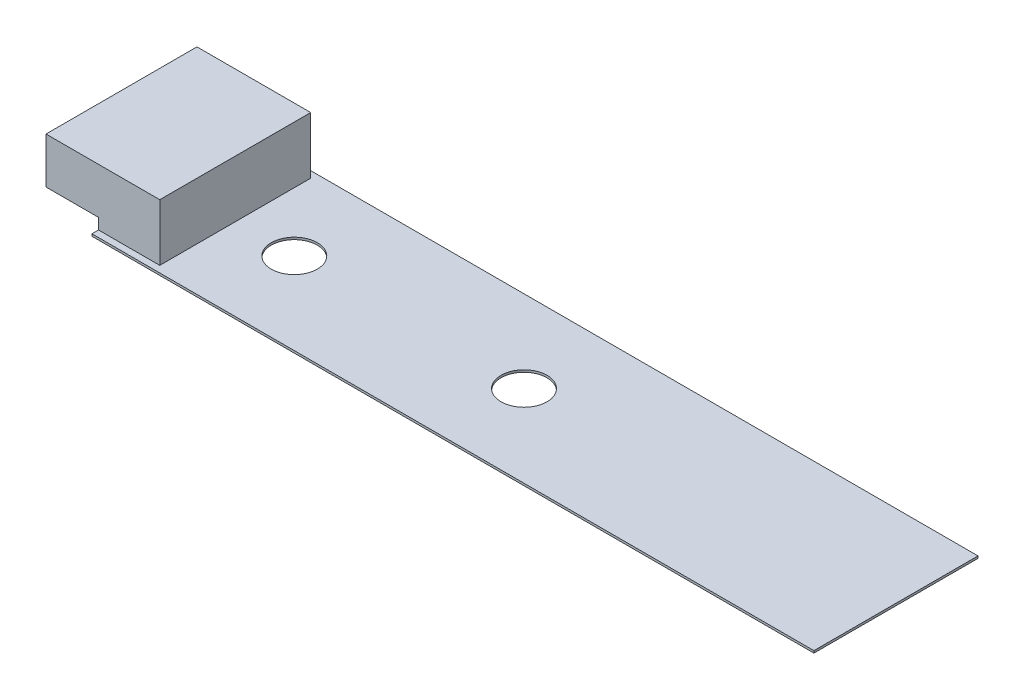
from build123d import *

# Parameters (mm, degrees)
SKETCH1_W           = 33
SKETCH1_H           = 7.5
BOSS_EXTRUDE1_DEPTH = 0.1
SKETCH2_W           = 5.2
SKETCH2_H           = 6.9
BOSS_EXTRUDE2_DEPTH = 2.6
CHAMFER1_SIZE       = 0.5
SKETCH3_R           = 1.05
CUT_EXTRUDE1_DEPTH  = 2.6


with BuildPart() as part:
    # Sketch1 → Boss-Extrude1 (new body)
    with BuildSketch(Plane(origin=(0, 0, 0), x_dir=(1, 0, 0), z_dir=(0, 1, 0))):
        with Locations((16.5, 3.75)):
            Rectangle(SKETCH1_W, SKETCH1_H)
    extrude(amount=BOSS_EXTRUDE1_DEPTH)

    # Sketch2 → Boss-Extrude2 (add)
    with BuildSketch(Plane(origin=(0, 0.1, 0), x_dir=(1, 0, 0), z_dir=(0, 1, 0))):
        with Locations((0.2, 3.75)):
            Rectangle(SKETCH2_W, SKETCH2_H)
    extrude(amount=BOSS_EXTRUDE2_DEPTH)

    # Chamfer1
    chamfer1_edges = [part.edges().sort_by_distance(p)[0] for p in [
        (-1.2, 0.1, -0.3),
        (-1.2, 0.1, -7.2),
    ]]
    chamfer(chamfer1_edges, length=CHAMFER1_SIZE)

    # Sketch3 → Cut-Extrude1 (cut)
    with BuildSketch(Plane.XZ):
        with Locations(Location((5.5, -3.75, 0), (0, 0, 270))):
            Circle(SKETCH3_R)
        with Locations(Location((16, -3.75, 0), (0, 0, 270))):
            Circle(SKETCH3_R)
    extrude(amount=-CUT_EXTRUDE1_DEPTH, mode=Mode.SUBTRACT)


solid = part.part
